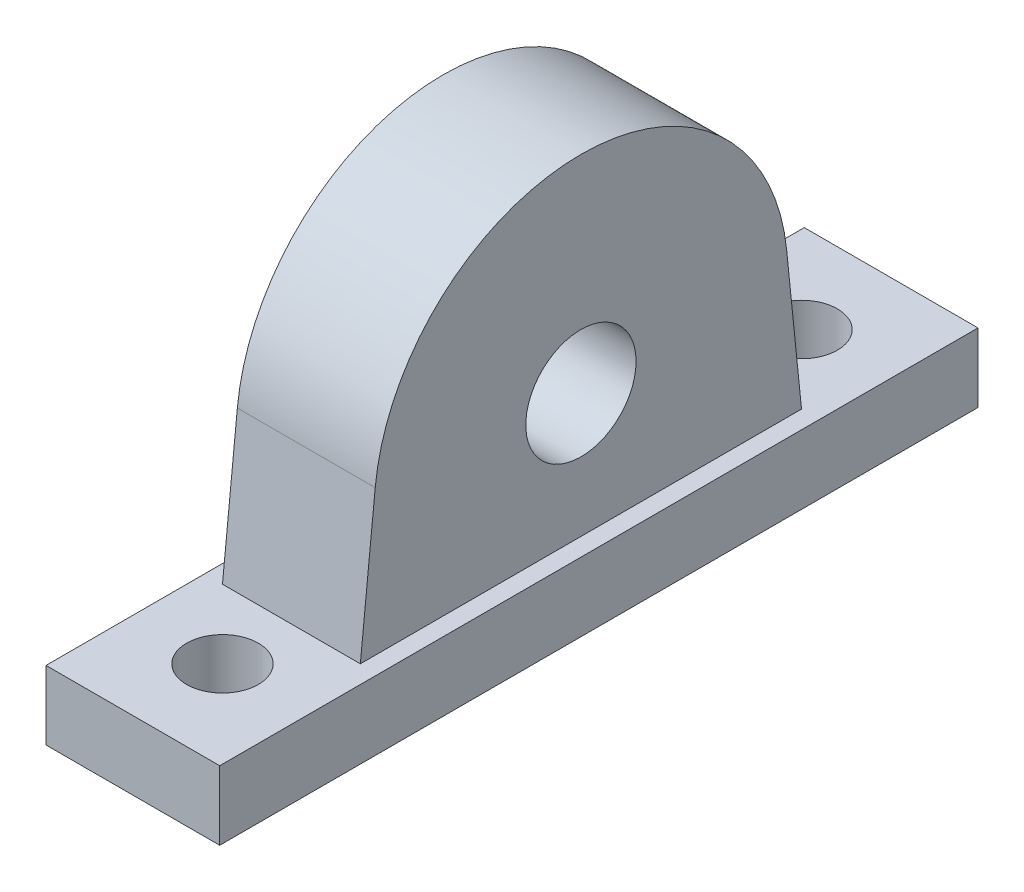
from build123d import *

# Parameters (mm, degrees)
SKETCH_1_W      = 12.6
SKETCH_1_H      = 55
SKETCH_1_R      = 2.6
EXTRUDE_1_DEPTH = 5
SKETCH_2_R      = 4
EXTRUDE_2_DEPTH = 5


with BuildPart() as part:
    # 草图1 → 凸台-拉伸1 (new body)
    with BuildSketch(Plane(origin=(0, 0, 0), x_dir=(1, 0, 0), z_dir=(0, 1, 0))):
        Rectangle(SKETCH_1_W, SKETCH_1_H)
        with Locations(Location((0, 21, 0), (0, 0, 270))):
            Circle(SKETCH_1_R, mode=Mode.SUBTRACT)
        with Locations(Location((0, -21, 0), (0, 0, 270))):
            Circle(SKETCH_1_R, mode=Mode.SUBTRACT)
    extrude(amount=EXTRUDE_1_DEPTH)

    # 草图2 → 凸台-拉伸2 (add, symmetric)
    with BuildSketch(Plane(origin=(0, 0, 0), x_dir=(0, 0, -1), z_dir=(1, 0, 0))):
        with BuildLine():
            Line((-16, 5), (-14.921975395, 15.527956257))
            ThreePointArc((-14.921975395, 15.527956257), (0, 29), (14.921975395, 15.527956257))
            Line((14.921975395, 15.527956257), (16, 5))
            Line((16, 5), (-16, 5))
        make_face()
        with Locations((0, 14)):
            Circle(SKETCH_2_R, mode=Mode.SUBTRACT)
    extrude(amount=EXTRUDE_2_DEPTH, both=True)


solid = part.part
